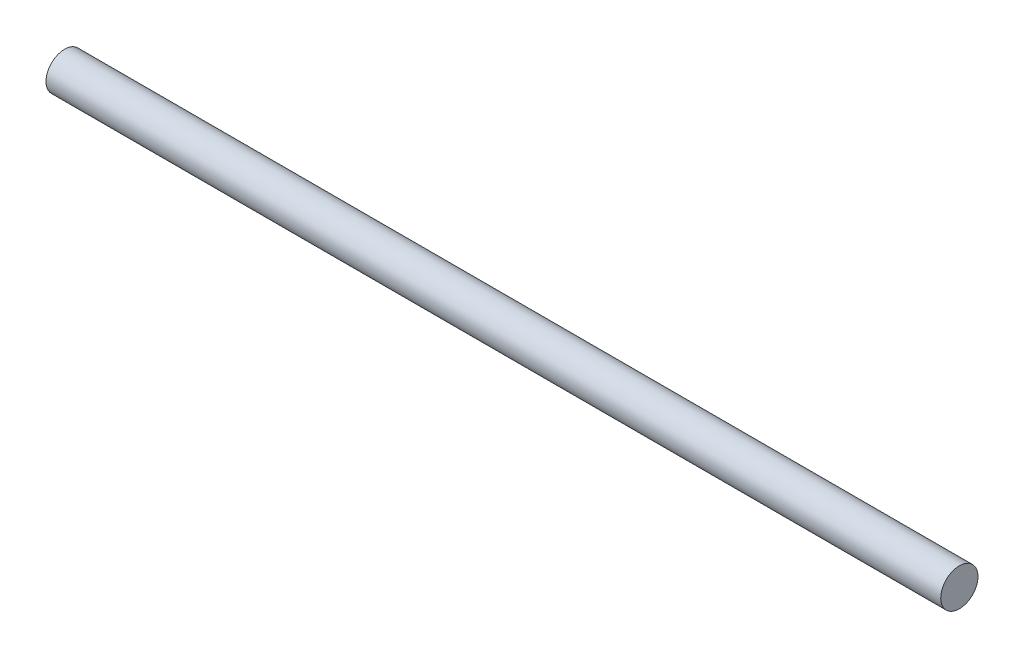
from build123d import *

# Parameters (mm, degrees)
ESQUISSE1_W = 240
ESQUISSE1_H = 5


with BuildPart() as part:
    # Esquisse1 → Révolution1 (revolve)
    with BuildSketch(Plane.XY, mode=Mode.PRIVATE) as r_volution1_sk:
        with Locations((-120, 2.5)):
            Rectangle(ESQUISSE1_W, ESQUISSE1_H)
    revolve(r_volution1_sk.sketch.rotate(Axis((0, 5, 0), (-1, 0, 0)), 180), axis=Axis((0, 5, 0), (-1, 0, 0)))


solid = part.part
